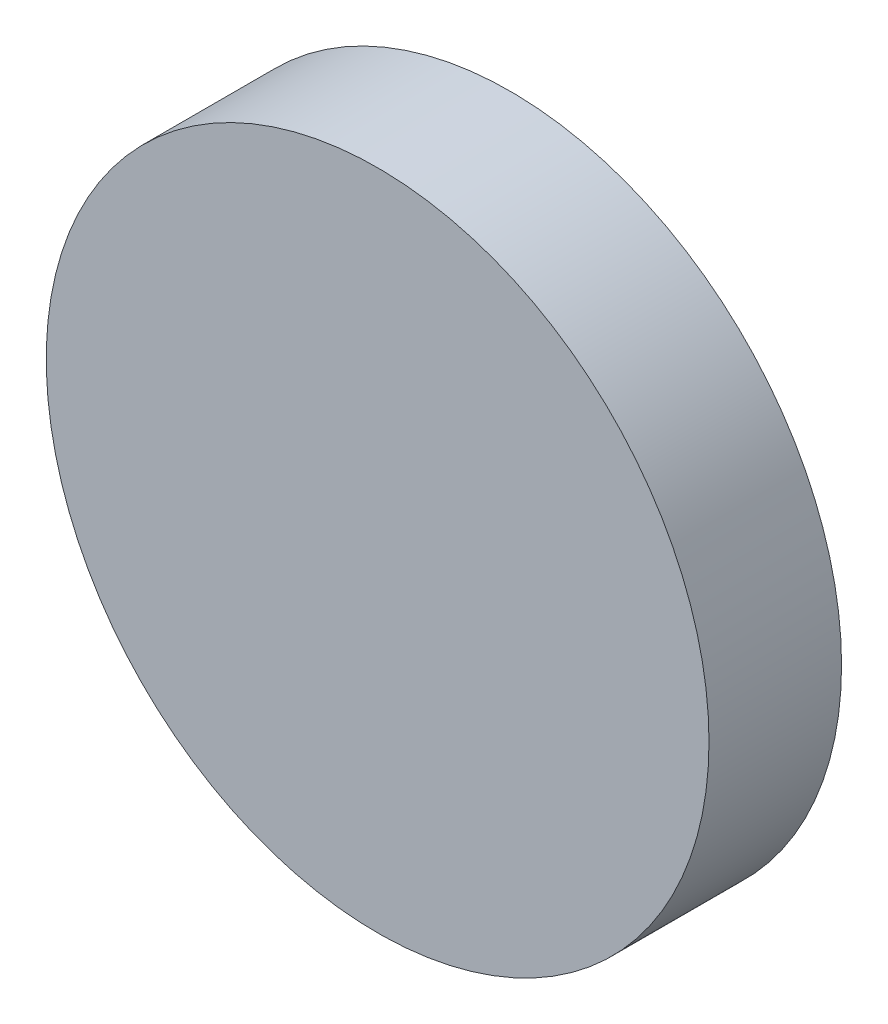
from build123d import *

# Parameters (mm, degrees)
SKETCH1_R           = 7.5
BOSS_EXTRUDE1_DEPTH = 3


with BuildPart() as part:
    # Sketch1 → Boss-Extrude1 (new body)
    with BuildSketch(Plane.XY):
        with Locations((-62.390580796, -116)):
            Circle(SKETCH1_R)
    extrude(amount=-BOSS_EXTRUDE1_DEPTH)


solid = part.part
